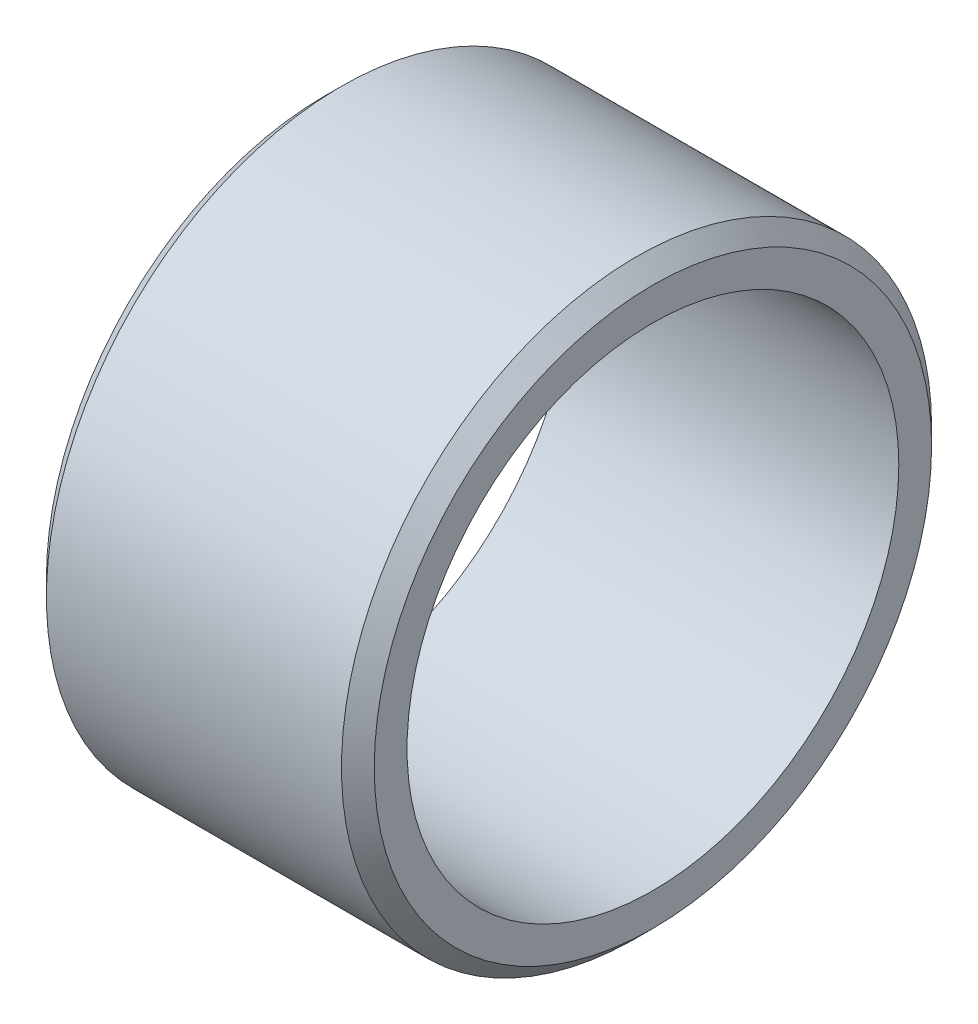
from build123d import *


with BuildPart() as part:
    # Sketch1 → Revolve1 (revolve)
    with BuildSketch(Plane.XY, mode=Mode.PRIVATE) as revolve1_sk:
        Polygon((0, 8.5), (0, 7.5), (10, 7.5), (10, 8.5), (9.5, 9), (0.5, 9), align=None)
    revolve(revolve1_sk.sketch.rotate(Axis((0, 0, 0), (1, 0, 0)), 270), axis=Axis((0, 0, 0), (1, 0, 0)))


solid = part.part
